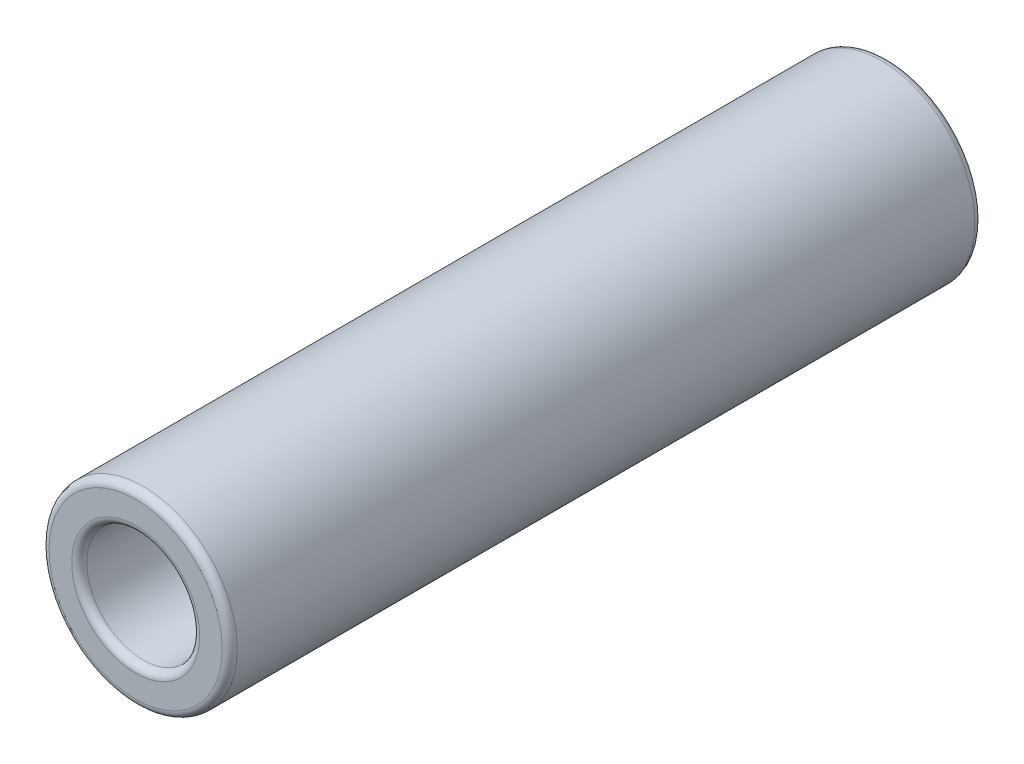
from build123d import *

# Parameters (mm, degrees)
SKETCH1_R           = 6.25
SKETCH1_R_2         = 3.75
BOSS_EXTRUDE1_DEPTH = 50
FILLET1_R           = 0.5


with BuildPart() as part:
    # Sketch1 → Boss-Extrude1 (new body)
    with BuildSketch(Plane.XY):
        Circle(SKETCH1_R)
        Circle(SKETCH1_R_2, mode=Mode.SUBTRACT)
    extrude(amount=BOSS_EXTRUDE1_DEPTH)

    # Fillet1
    fillet1_edges = [part.edges().sort_by_distance(p)[0] for p in [
        (-6.25, 0, 0),
        (-6.25, 0, 50),
        (-3.75, 0, 0),
        (-3.75, 0, 50),
    ]]
    fillet(fillet1_edges, radius=FILLET1_R)


solid = part.part
